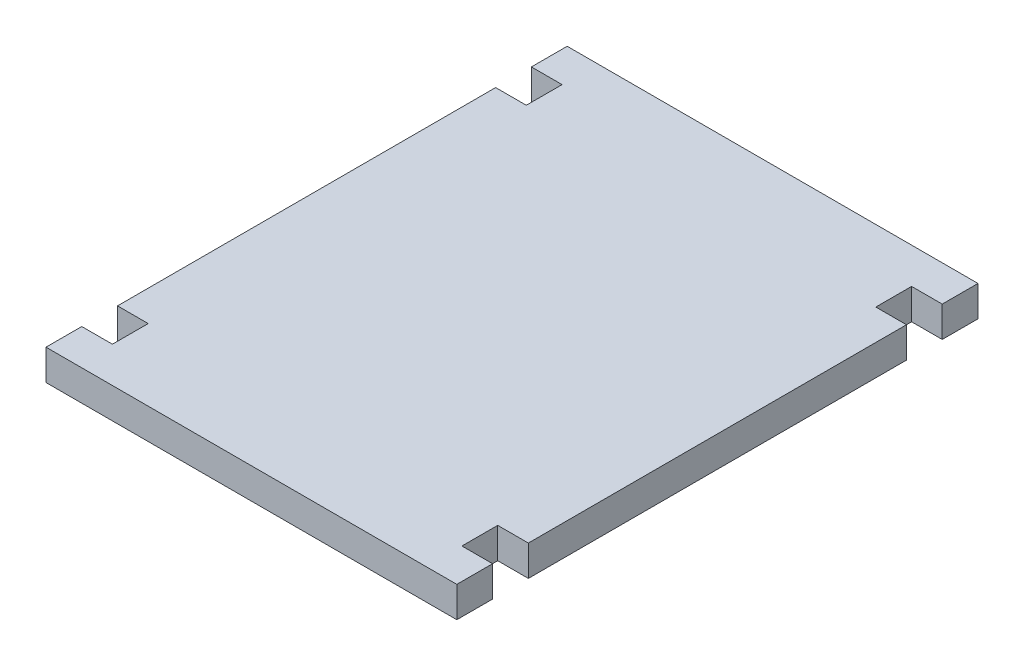
from build123d import *

# Parameters (mm, degrees)
SKETCH1_W           = 67
SKETCH1_H           = 85
BOSS_EXTRUDE1_DEPTH = 5
SKETCH2_W           = 5
SKETCH2_H           = 5.833333
CUT_EXTRUDE1_DEPTH  = 55.346113016


with BuildPart() as part:
    # Sketch1 → Boss-Extrude1 (new body)
    with BuildSketch(Plane(origin=(0, 0, 0), x_dir=(1, 0, 0), z_dir=(0, 1, 0))):
        Rectangle(SKETCH1_W, SKETCH1_H)
    extrude(amount=BOSS_EXTRUDE1_DEPTH)

    # Sketch2 → Cut-Extrude1 (cut, through all)
    with BuildSketch(Plane(origin=(0, 5, 0), x_dir=(1, 0, 0), z_dir=(0, 1, 0))):
        with Locations((-31, -33.7500005)):
            Rectangle(SKETCH2_W, SKETCH2_H)
        with Locations((-31, 33.7500005)):
            Rectangle(SKETCH2_W, SKETCH2_H)
        with Locations((31, -33.7500005)):
            Rectangle(SKETCH2_W, SKETCH2_H)
        with Locations((31, 33.7500005)):
            Rectangle(SKETCH2_W, SKETCH2_H)
    extrude(amount=-CUT_EXTRUDE1_DEPTH, mode=Mode.SUBTRACT)


solid = part.part
